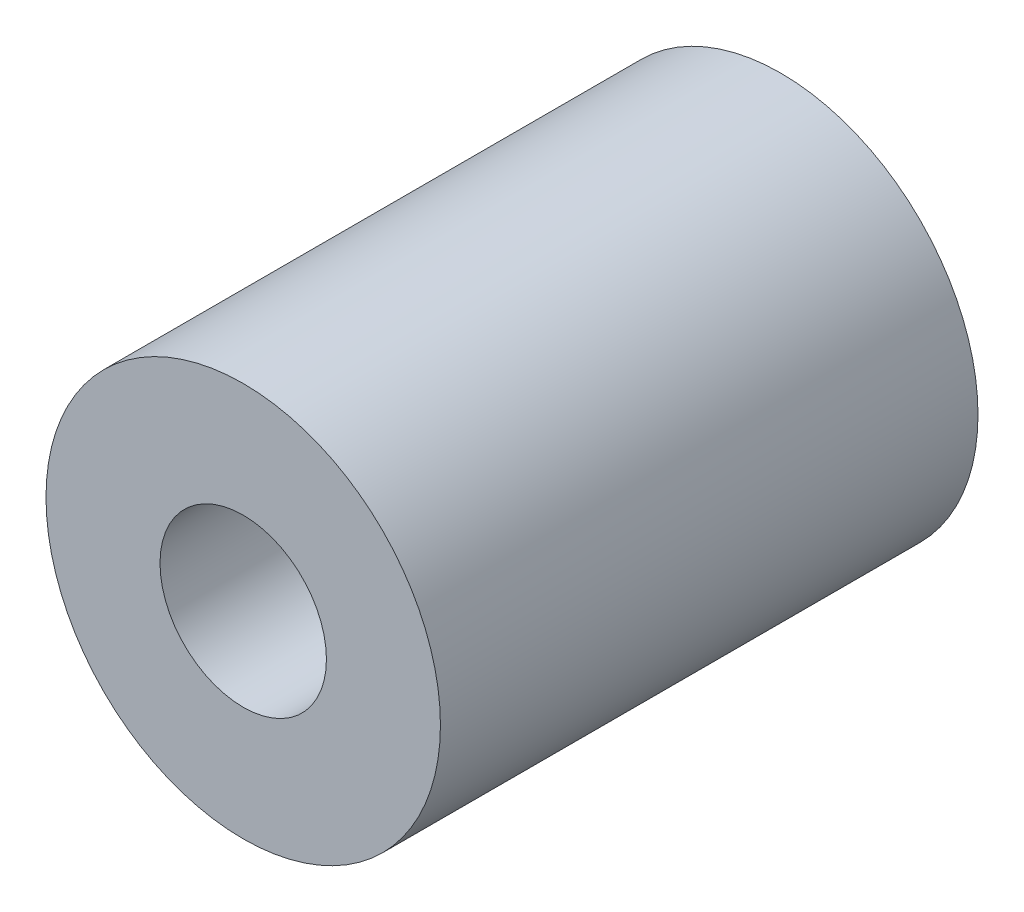
from build123d import *

# Parameters (mm, degrees)
ESBO_O1_R                = 5.925
ESBO_O1_R_2              = 2.5
RESSALTO_EXTRUS_O1_DEPTH = 16.15


with BuildPart() as part:
    # Esboço1 → Ressalto-extrusão1 (new body)
    with BuildSketch(Plane.XY):
        Circle(ESBO_O1_R)
        Circle(ESBO_O1_R_2, mode=Mode.SUBTRACT)
    extrude(amount=RESSALTO_EXTRUS_O1_DEPTH)


solid = part.part
